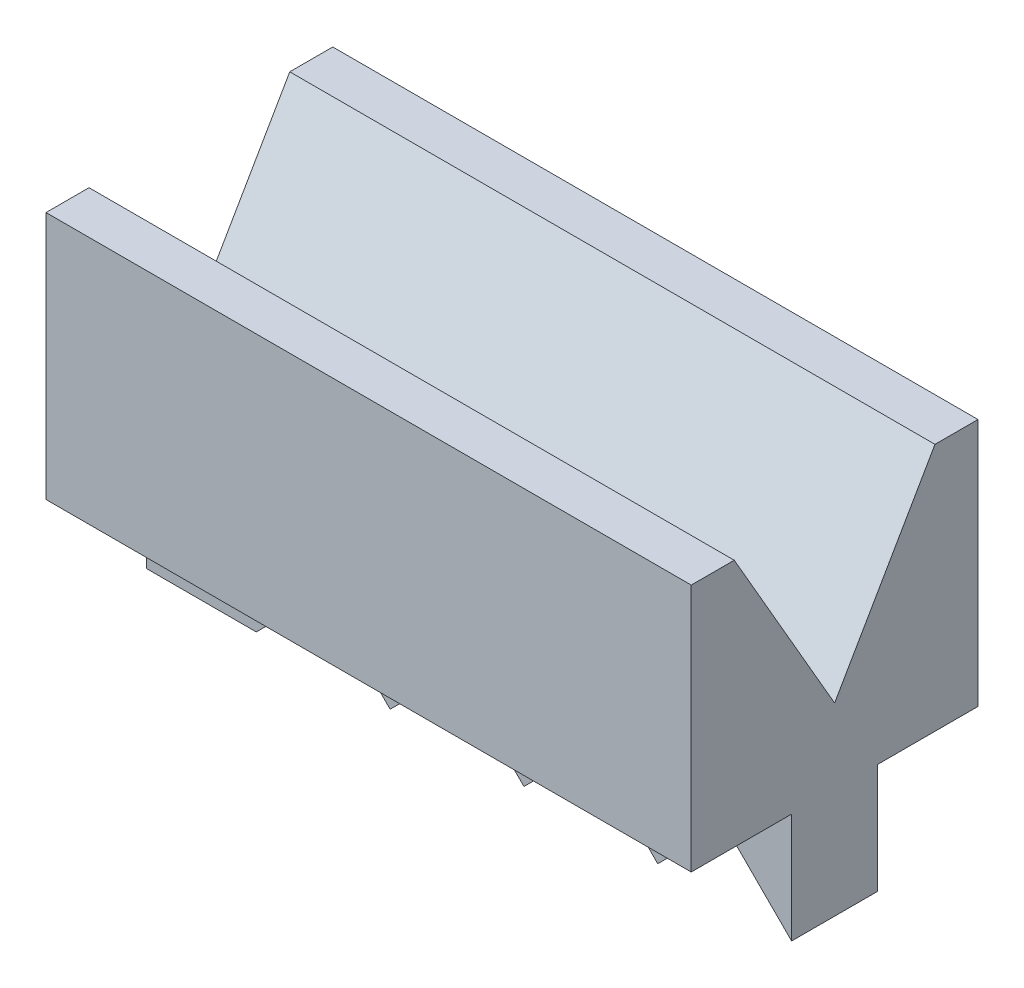
from build123d import *

# Parameters (mm, degrees)
BOSS_EXTRUDE1_DEPTH = 135
CUT_EXTRUDE1_REACH  = 151.833


with BuildPart() as part:
    # Sketch2 → Boss-Extrude1 (new body)
    with BuildSketch(Plane(origin=(0, 0, 0), x_dir=(0, 0, 1), z_dir=(1, 0, 0))):
        Polygon((-9, 23), (9, 23), (9, 0), (30, 0), (30, -52), (21, -52), (0, -15.626933041), (-21, -52), (-30, -52), (-30, 0), (-9, 0), align=None)
    extrude(amount=BOSS_EXTRUDE1_DEPTH)

    # Sketch3 → Cut-Extrude1 (cut, up to next)
    with BuildSketch(Plane(origin=(0, 0, -9), x_dir=(-1, 0, 0), z_dir=(0, 0, -1)), mode=Mode.PRIVATE) as cut_extrude1_sk1:
        Polygon((-65, -9), (-79, -23), (-51, -23), align=None)
    cut_extrude1_tool1 = extrude(cut_extrude1_sk1.sketch, amount=-CUT_EXTRUDE1_REACH, mode=Mode.PRIVATE) & part.part
    # Sketch3 → Cut-Extrude1 (cut, up to next)
    with BuildSketch(Plane(origin=(0, 0, -9), x_dir=(-1, 0, 0), z_dir=(0, 0, -1)), mode=Mode.PRIVATE) as cut_extrude1_sk2:
        Polygon((-93, -9), (-107, -23), (-79, -23), align=None)
    cut_extrude1_tool2 = extrude(cut_extrude1_sk2.sketch, amount=-CUT_EXTRUDE1_REACH, mode=Mode.PRIVATE) & part.part
    # Sketch3 → Cut-Extrude1 (cut, up to next)
    with BuildSketch(Plane(origin=(0, 0, -9), x_dir=(-1, 0, 0), z_dir=(0, 0, -1)), mode=Mode.PRIVATE) as cut_extrude1_sk3:
        Polygon((-121, -9), (-135, -23), (-107, -23), align=None)
    cut_extrude1_tool3 = extrude(cut_extrude1_sk3.sketch, amount=-CUT_EXTRUDE1_REACH, mode=Mode.PRIVATE) & part.part
    # Sketch3 → Cut-Extrude1 (cut, up to next)
    with BuildSketch(Plane(origin=(0, 0, -9), x_dir=(-1, 0, 0), z_dir=(0, 0, -1)), mode=Mode.PRIVATE) as cut_extrude1_sk4:
        Polygon((-37, -9), (-51, -23), (-23, -23), align=None)
    cut_extrude1_tool4 = extrude(cut_extrude1_sk4.sketch, amount=-CUT_EXTRUDE1_REACH, mode=Mode.PRIVATE) & part.part
    add(cut_extrude1_tool1.solids().sort_by_distance((65, -18.333333, -9))[0], mode=Mode.SUBTRACT)
    add(cut_extrude1_tool2.solids().sort_by_distance((93, -18.333333, -9))[0], mode=Mode.SUBTRACT)
    add(cut_extrude1_tool3.solids().sort_by_distance((121, -18.333333, -9))[0], mode=Mode.SUBTRACT)
    add(cut_extrude1_tool4.solids().sort_by_distance((37, -18.333333, -9))[0], mode=Mode.SUBTRACT)


solid = part.part
